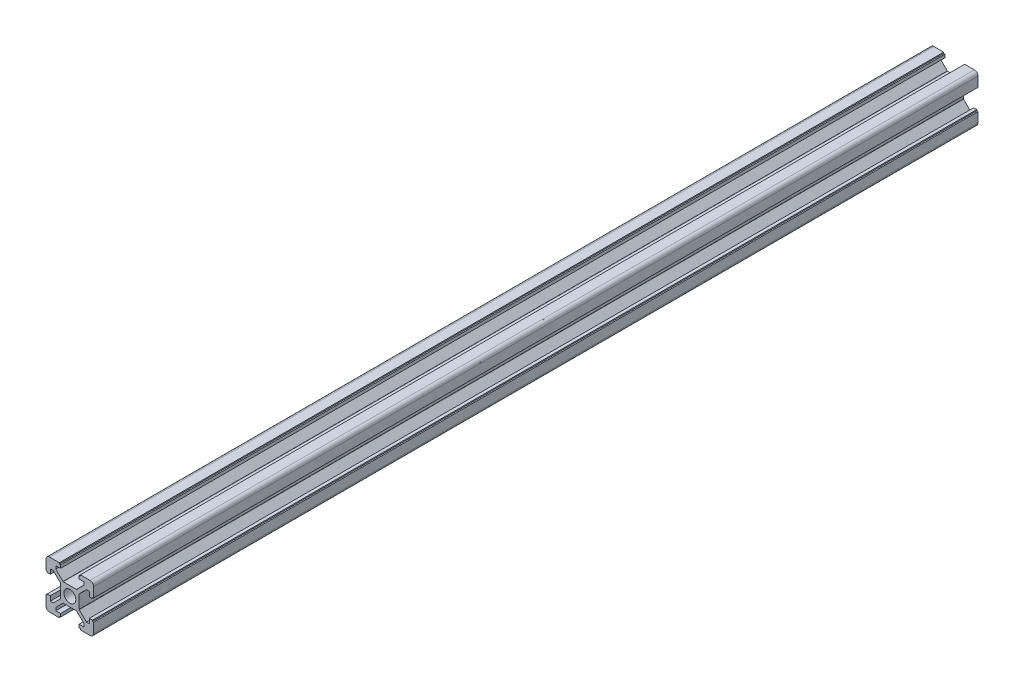
from build123d import *

# Parameters (mm, degrees)
SKETCH_1_R      = 2.5
EXTRUDE_1_DEPTH = 371
FILLET_1_R      = 1.5
FILLET_2_R      = 0.2


with BuildPart() as part:
    # 草图1 → 凸台-拉伸1 (new body)
    with BuildSketch(Plane.XY):
        Polygon((-10, 10), (-4.4, 10), (-4.4, 9.5), (-3.9, 9.5), (-3.9, 8.2), (-5.9, 8.2), (-5.9, 6.960660172), (-2.839608303, 3.900131414), (2.839471243, 3.900131414), (5.9, 6.960660172), (5.9, 8.2), (3.9, 8.2), (3.9, 9.5), (4.4, 9.5), (4.4, 10), (10, 10), (10, 4.4), (9.5, 4.4), (9.5, 3.9), (8.2, 3.9), (8.2, 5.9), (6.960660172, 5.9), (3.900131414, 2.839608303), (3.900131414, -2.839471243), (6.960660172, -5.9), (8.2, -5.9), (8.2, -3.9), (9.5, -3.9), (9.5, -4.4), (10, -4.4), (10, -10), (4.4, -10), (4.4, -9.5), (3.9, -9.5), (3.9, -8.2), (5.9, -8.2), (5.9, -6.960660172), (2.839471243, -3.899994348), (-2.839334176, -3.899994348), (-5.9, -6.960660172), (-5.9, -8.2), (-3.9, -8.2), (-3.9, -9.5), (-4.4, -9.5), (-4.4, -10), (-10, -10), (-10, -4.4), (-9.5, -4.4), (-9.5, -3.9), (-8.2, -3.9), (-8.2, -5.9), (-6.960660172, -5.9), (-3.899994348, -2.839471243), (-3.899994348, 2.839334176), (-6.960660172, 5.9), (-8.2, 5.9), (-8.2, 3.9), (-9.5, 3.9), (-9.5, 4.4), (-10, 4.4), align=None)
        Circle(SKETCH_1_R, mode=Mode.SUBTRACT)
    extrude(amount=EXTRUDE_1_DEPTH)

    # 圆角1
    fillet_1_edges = [part.edges().sort_by_distance(p)[0] for p in [
        (10, 10, 185.5),
        (10, -10, 185.5),
        (-10, -10, 185.5),
        (-10, 10, 185.5),
    ]]
    fillet(fillet_1_edges, radius=FILLET_1_R)

    # 圆角2
    fillet_2_edges = [part.edges().sort_by_distance(p)[0] for p in [
        (3.900131414, 2.839608303, 185.5),
        (3.900131414, -2.839471243, 185.5),
        (2.839471243, -3.899994348, 185.5),
        (-2.839334176, -3.899994348, 185.5),
        (-3.899994348, -2.839471243, 185.5),
        (-3.899994348, 2.839334176, 185.5),
        (-2.839608303, 3.900131414, 185.5),
        (2.839471243, 3.900131414, 185.5),
    ]]
    fillet(fillet_2_edges, radius=FILLET_2_R)


solid = part.part
